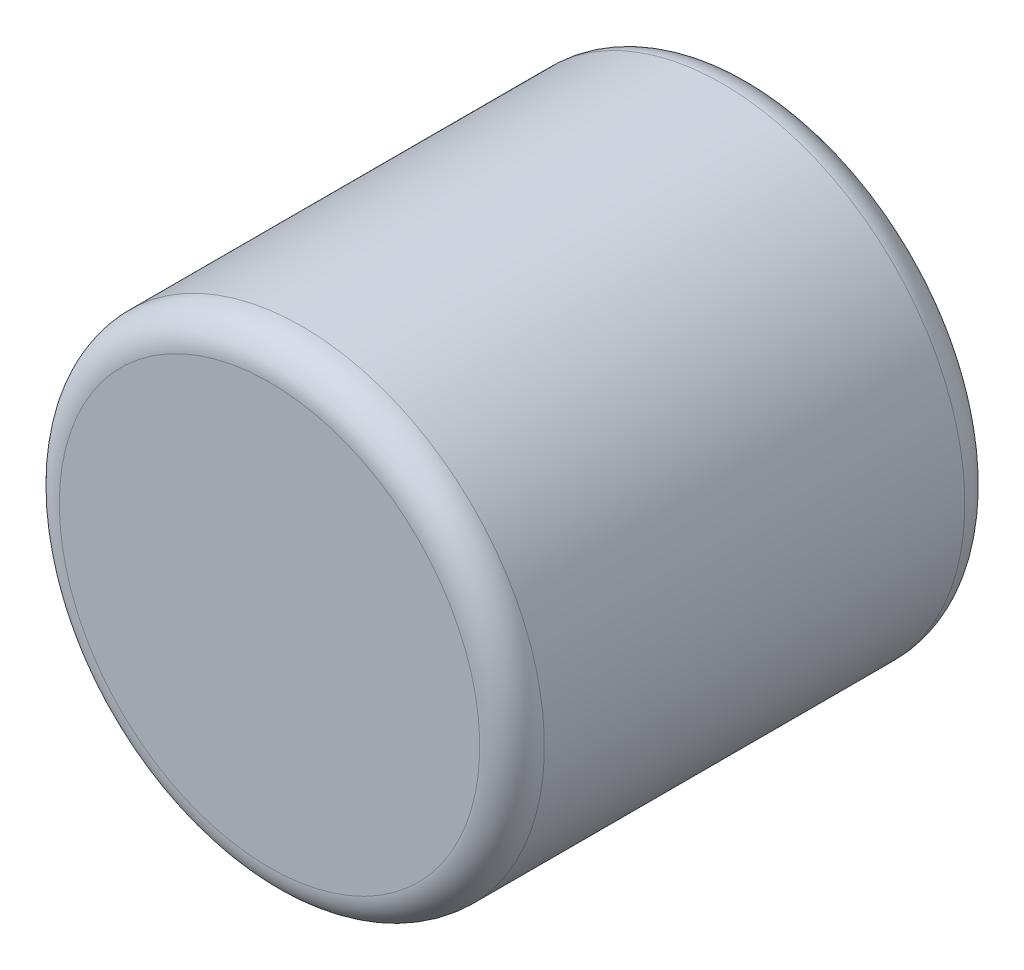
from build123d import *


with BuildPart() as part:
    # Эскиз2 → Повернуть1 (revolve)
    with BuildSketch(Plane(origin=(0, 0, 0), x_dir=(0, 0, -1), z_dir=(1, 0, 0)), mode=Mode.PRIVATE) as revolve_1_sk:
        with BuildLine():
            Line((0, 0), (-3, 0))
            Line((-3, 0), (-3, -1.3))
            ThreePointArc((-3, -1.3), (-2.941421356, -1.441421356), (-2.8, -1.5))
            Line((-2.8, -1.5), (-0.2, -1.5))
            ThreePointArc((-0.2, -1.5), (-0.058578644, -1.441421356), (0, -1.3))
            Line((0, -1.3), (0, 0))
        make_face()
    revolve(revolve_1_sk.sketch.rotate(Axis((0, 0, 0), (0, 0, 1)), 270), axis=Axis((0, 0, 0), (0, 0, 1)))


solid = part.part
